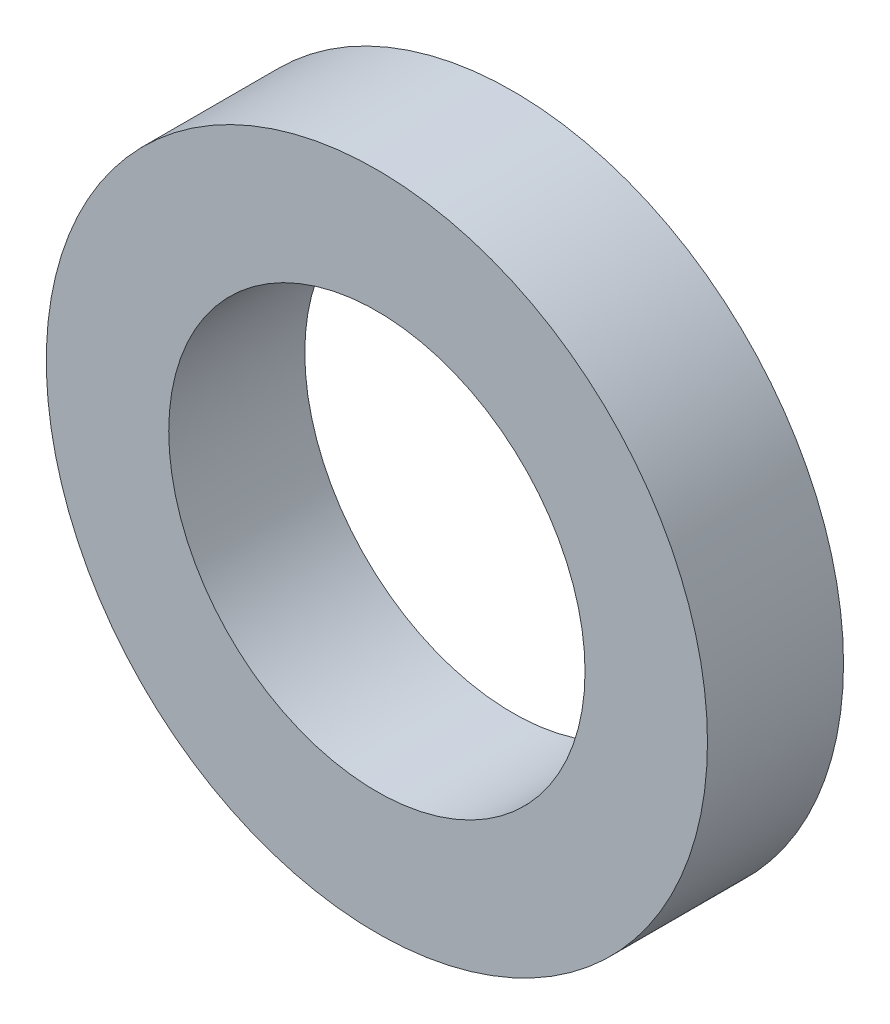
from build123d import *

# Parameters (mm, degrees)
SKETCH_1_R      = 12.15
SKETCH_1_R_2    = 7.65
EXTRUDE_1_DEPTH = 5


with BuildPart() as part:
    # Эскиз1 → Бобышка-Вытянуть1 (new body)
    with BuildSketch(Plane.XY):
        Circle(SKETCH_1_R)
        Circle(SKETCH_1_R_2, mode=Mode.SUBTRACT)
    extrude(amount=EXTRUDE_1_DEPTH)


solid = part.part
